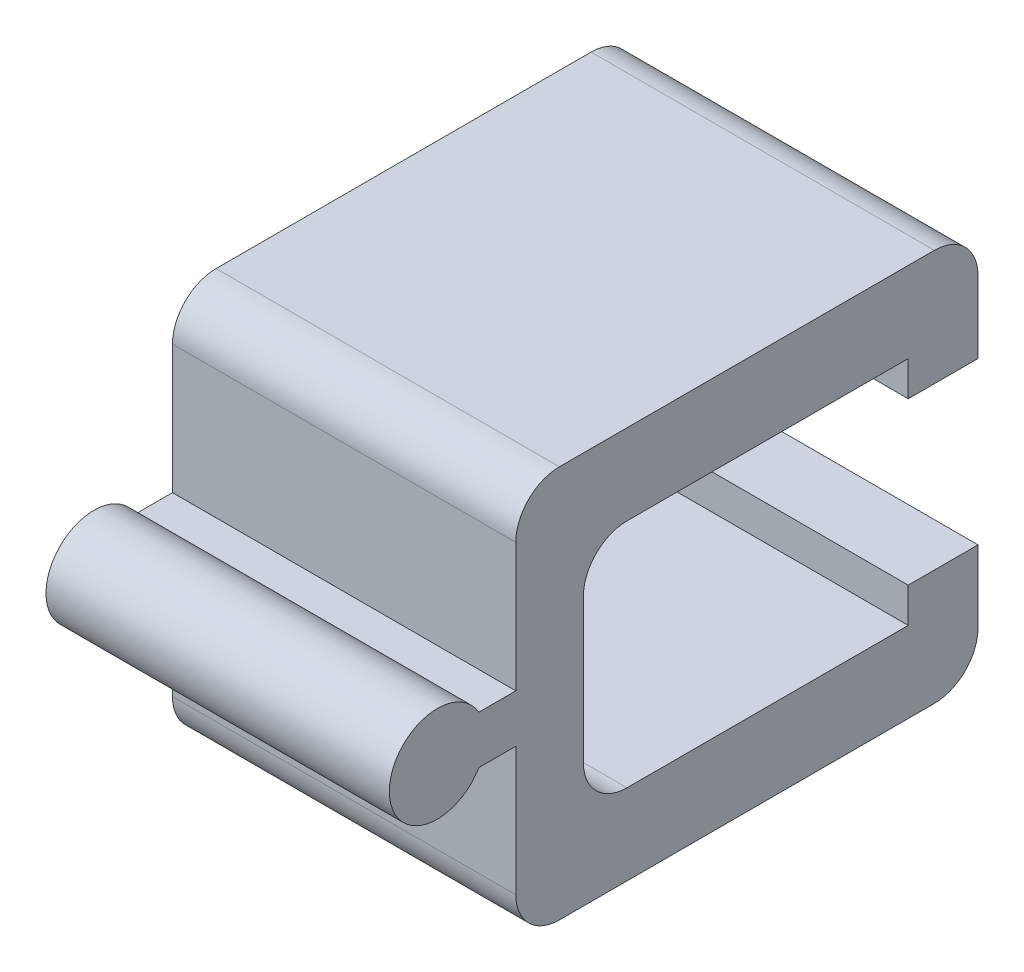
from build123d import *

# Parameters (mm, degrees)
MAINBODY_DEPTH      = 5
BOSS_EXTRUDE4_DEPTH = 10
FILLET4_R           = 1.27


with BuildPart() as part:
    # Sketch1 → MainBody (new, symmetric)
    with BuildSketch(Plane(origin=(0, 0, 0), x_dir=(0, 0, -1), z_dir=(1, 0, 0))):
        Polygon((106.918290099, 0.604217668), (93.456290099, 0.604217668), (93.456290099, -10.825782332), (106.918290099, -10.825782332), (106.918290099, -7.460282332), (104.886290099, -7.460282332), (104.886290099, -8.476282332), (95.424790099, -8.476282332), (95.424790099, -1.745282332), (104.886290099, -1.745282332), (104.886290099, -2.761282332), (106.918290099, -2.761282332), align=None)
    extrude(amount=MAINBODY_DEPTH, both=True)

    # Sketch10 → Boss-Extrude4 (add)
    with BuildSketch(Plane(origin=(5, 0, 0), x_dir=(0, 0, -1), z_dir=(1, 0, 0))):
        with BuildLine():
            Line((91.170290099, -5.809282332), (91.170290099, -5.110782332))
            Line((91.170290099, -5.110782332), (91.170290099, -4.412282332))
            Line((91.170290099, -4.412282332), (92.380127588, -4.412282332))
            ThreePointArc((92.380127588, -4.412282332), (89.773290099, -5.110782332), (92.380127588, -5.809282332))
            Line((92.380127588, -5.809282332), (91.170290099, -5.809282332))
        make_face()
        with BuildLine():
            Line((91.170290099, -4.412282332), (91.170290099, -5.110782332))
            Line((91.170290099, -5.110782332), (92.567290099, -5.110782332))
            ThreePointArc((92.567290099, -5.110782332), (92.519688478, -4.749212126), (92.380127588, -4.412282332))
            Line((92.380127588, -4.412282332), (91.170290099, -4.412282332))
        make_face()
        with BuildLine():
            Line((92.567290099, -5.110782332), (91.170290099, -5.110782332))
            Line((91.170290099, -5.110782332), (91.170290099, -5.809282332))
            Line((91.170290099, -5.809282332), (92.380127588, -5.809282332))
            ThreePointArc((92.380127588, -5.809282332), (92.519688478, -5.472352538), (92.567290099, -5.110782332))
        make_face()
        with BuildLine():
            ThreePointArc((92.380127588, -4.412282332), (92.519688478, -4.749212126), (92.567290099, -5.110782332))
            Line((92.567290099, -5.110782332), (93.456290099, -5.110782332))
            Line((93.456290099, -5.110782332), (93.456290099, -4.412282332))
            Line((93.456290099, -4.412282332), (92.380127588, -4.412282332))
        make_face()
        with BuildLine():
            Line((93.456290099, -5.110782332), (92.567290099, -5.110782332))
            ThreePointArc((92.567290099, -5.110782332), (92.519688478, -5.472352538), (92.380127588, -5.809282332))
            Line((92.380127588, -5.809282332), (93.456290099, -5.809282332))
            Line((93.456290099, -5.809282332), (93.456290099, -5.110782332))
        make_face()
    extrude(amount=-BOSS_EXTRUDE4_DEPTH)

    # Fillet4
    fillet4_edges = [part.edges().sort_by_distance(p)[0] for p in [
        (0, -1.745282332, -95.424790099),
        (0, -8.476282332, -95.424790099),
        (0, -10.825782332, -106.918290099),
        (0, -10.825782332, -93.456290099),
        (0, 0.604217668, -93.456290099),
        (0, 0.604217668, -106.918290099),
    ]]
    fillet(fillet4_edges, radius=FILLET4_R)


solid = part.part
